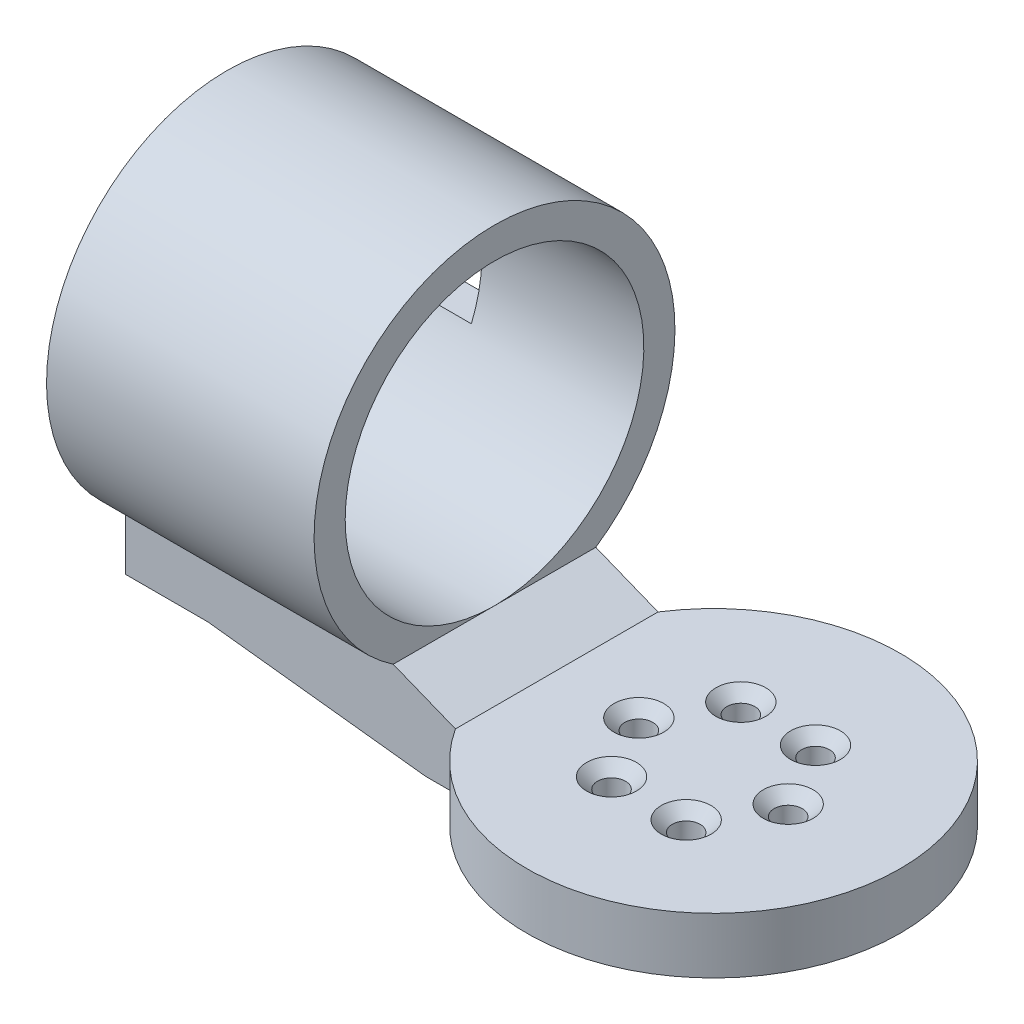
from build123d import *

# Parameters (mm, degrees)
BOSS_EXTRUDE1_DEPTH                             = 5
CSK_FOR_M4_FLAT_HEAD_MACHINE_SCREW2_D           = 4.5
CSK_FOR_M4_FLAT_HEAD_MACHINE_SCREW2_CSINK_D     = 8
CSK_FOR_M4_FLAT_HEAD_MACHINE_SCREW2_CSINK_ANGLE = 90
SKETCH11_R                                      = 29
SKETCH11_R_2                                    = 24
BOSS_EXTRUDE2_DEPTH                             = 37
BOSS_EXTRUDE3_START                             = 6
BOSS_EXTRUDE3_DEPTH                             = 6
CSK_FOR_M3_FLAT_HEAD_MACHINE_SCREW1_D           = 3.4
CSK_FOR_M3_FLAT_HEAD_MACHINE_SCREW1_CSINK_D     = 6.1
CSK_FOR_M3_FLAT_HEAD_MACHINE_SCREW1_CSINK_ANGLE = 90
CUT_EXTRUDE1_REACH                              = 117.931
CUT_EXTRUDE1_END_RADIUS                         = 24
SKETCH15_W                                      = 7
SKETCH15_H                                      = 16
CUT_EXTRUDE2_START                              = -5
SKETCH17_R                                      = 2.9
CUT_EXTRUDE2_DEPTH                              = 1
CHAMFER1_SIZE                                   = 0.8
BOSS_EXTRUDE4_START                             = -43
BOSS_EXTRUDE4_DEPTH                             = 43
BOSS_EXTRUDE5_DEPTH                             = 16.28
BOSS_EXTRUDE6_START                             = 4
SKETCH21_R                                      = 30
SKETCH21_R_2                                    = 25
BOSS_EXTRUDE6_DEPTH                             = 4
BOSS_EXTRUDE7_DEPTH                             = 32.56


with BuildPart() as part:
    # Sketch1 → Boss-Extrude1 (new body)
    with BuildSketch(Plane(origin=(0, 0, 0), x_dir=(1, 0, 0), z_dir=(0, 1, 0))):
        with BuildLine():
            Line((-25.198444396, -16.28), (-72.198444396, -16.28))
            Line((-72.198444396, -16.28), (-72.198444396, 16.28))
            Line((-72.198444396, 16.28), (-25.198444396, 16.28))
            ThreePointArc((-25.198444396, 16.28), (30, 0), (-25.198444396, -16.28))
        make_face()
    extrude(amount=BOSS_EXTRUDE1_DEPTH)

    # CSK for M4 Flat Head Machine Screw2 (through all)
    with Locations(Plane(origin=(0, 5, 0), x_dir=(1, 0, 0), z_dir=(0, 1, 0))):
        with Locations((-6, 10.392304845), (-12, 0), (12, 0), (6, 10.392304845), (-6, -10.392304845), (6, -10.392304845)):
            CounterSinkHole(CSK_FOR_M4_FLAT_HEAD_MACHINE_SCREW2_D / 2, CSK_FOR_M4_FLAT_HEAD_MACHINE_SCREW2_CSINK_D / 2, counter_sink_angle=CSK_FOR_M4_FLAT_HEAD_MACHINE_SCREW2_CSINK_ANGLE)

    # Sketch11 → Boss-Extrude2 (add)
    with BuildSketch(Plane.ZY.offset(72.198444396)):
        with Locations((0, 33)):
            Circle(SKETCH11_R)
        with Locations((0, 33)):
            Circle(SKETCH11_R_2, mode=Mode.SUBTRACT)
    extrude(amount=-BOSS_EXTRUDE2_DEPTH)

    # Sketch12 → Boss-Extrude3 (add)
    with BuildSketch(Plane.ZY.offset(72.198444396).offset(BOSS_EXTRUDE3_START)):
        with BuildLine():
            Line((-16.28, 0), (16.28, 0))
            Line((16.28, 0), (16.28, 5))
            Line((16.28, 5), (7.549834435, 5))
            ThreePointArc((7.549834435, 5), (0, 62), (-7.549834435, 5))
            Line((-7.549834435, 5), (-16.28, 5))
            Line((-16.28, 5), (-16.28, 0))
        make_face()
    extrude(amount=-BOSS_EXTRUDE3_DEPTH)

    # CSK for M3 Flat Head Machine Screw1 (through all)
    with Locations(Plane.ZY.offset(78.198444396)):
        with Locations((-11.584939196, 17.626266432), (11.584939196, 48.373733568), (15.373733568, 21.415060804), (-15.373733568, 44.584939196)):
            CounterSinkHole(CSK_FOR_M3_FLAT_HEAD_MACHINE_SCREW1_D / 2, CSK_FOR_M3_FLAT_HEAD_MACHINE_SCREW1_CSINK_D / 2, counter_sink_angle=CSK_FOR_M3_FLAT_HEAD_MACHINE_SCREW1_CSINK_ANGLE)

    # Cut-Extrude1: up to this cylinder (the profile starts outside it)
    cut_extrude1_end = Plane(origin=(-64.698444, 33, 0), z_dir=(-1, 0, 0)) * Cylinder(CUT_EXTRUDE1_END_RADIUS, 284.862, mode=Mode.PRIVATE)
    # Sketch15 → Cut-Extrude1 (cut, up to the surface)
    with BuildSketch(Plane(origin=(0, 0, -29), x_dir=(-1, 0, 0), z_dir=(0, 0, -1)), mode=Mode.PRIVATE) as cut_extrude1_sk1:
        with Locations((64.698444396, 32.1)):
            Rectangle(SKETCH15_W, SKETCH15_H)
    cut_extrude1_tool1 = extrude(cut_extrude1_sk1.sketch, amount=-CUT_EXTRUDE1_REACH, mode=Mode.PRIVATE) - cut_extrude1_end
    add(cut_extrude1_tool1.solids().sort_by_distance((-64.698444, 32.1, -29))[0], mode=Mode.SUBTRACT)

    # Sketch17 → Cut-Extrude2 (cut)
    with BuildSketch(Plane(origin=(0, 5, 0), x_dir=(1, 0, 0), z_dir=(0, 1, 0)).offset(CUT_EXTRUDE2_START)):
        with Locations(Location((-7.664324823, 4.425, 0), (0, 0, 270))):
            Circle(SKETCH17_R)
        with Locations(Location((7.664324823, 4.425, 0), (0, 0, 270))):
            Circle(SKETCH17_R)
        with Locations(Location((0, -8.849999999, 0), (0, 0, 270))):
            Circle(SKETCH17_R)
    extrude(amount=CUT_EXTRUDE2_DEPTH, mode=Mode.SUBTRACT)

    # Chamfer1
    chamfer1_edges = [part.edges().sort_by_distance(p)[0] for p in [
        (7.664324823, 0, -7.325),
        (-7.664324823, 0, -7.325),
        (0, 0, 5.949999999),
    ]]
    chamfer(chamfer1_edges, length=CHAMFER1_SIZE)

    # Sketch19 → Boss-Extrude4 (add)
    with BuildSketch(Plane(origin=(-35.198444396, 0, 0), x_dir=(0, 0, -1), z_dir=(1, 0, 0)).offset(BOSS_EXTRUDE4_START)):
        with BuildLine():
            ThreePointArc((-7.549834435, 5), (-12.081674242, 6.636518676), (-16.28, 9.000800013))
            Line((-16.28, 9.000800013), (-16.28, 5))
            Line((-16.28, 5), (-7.549834435, 5))
        make_face()
        with BuildLine():
            Line((16.28, 5), (16.28, 9.000800013))
            ThreePointArc((16.28, 9.000800013), (12.081674242, 6.636518676), (7.549834435, 5))
            Line((7.549834435, 5), (16.28, 5))
        make_face()
    extrude(amount=BOSS_EXTRUDE4_DEPTH)

    # Sketch20 → Boss-Extrude5 (add, symmetric)
    with BuildSketch(Plane.XY):
        Polygon((-35.198444396, 9.000800013), (-25.198444396, 5), (-35.198444396, 5), align=None)
    extrude(amount=BOSS_EXTRUDE5_DEPTH, both=True)

    # Sketch21 → Boss-Extrude6 (add)
    with BuildSketch(Plane.XZ.offset(BOSS_EXTRUDE6_START)):
        with Locations(Location((0, 0, 0), (0, 0, 270))):
            Circle(SKETCH21_R)
        with Locations(Location((0, 0, 0), (0, 0, 270))):
            Circle(SKETCH21_R_2, mode=Mode.SUBTRACT)
    extrude(amount=-BOSS_EXTRUDE6_DEPTH)

    # Sketch22 → Boss-Extrude7 (add)
    with BuildSketch(Plane.XY.offset(16.28)):
        Polygon((-65, 0), (-25.198444396, 0), (-25, -4), (-30, -4), align=None)
    extrude(amount=-BOSS_EXTRUDE7_DEPTH)


solid = part.part
